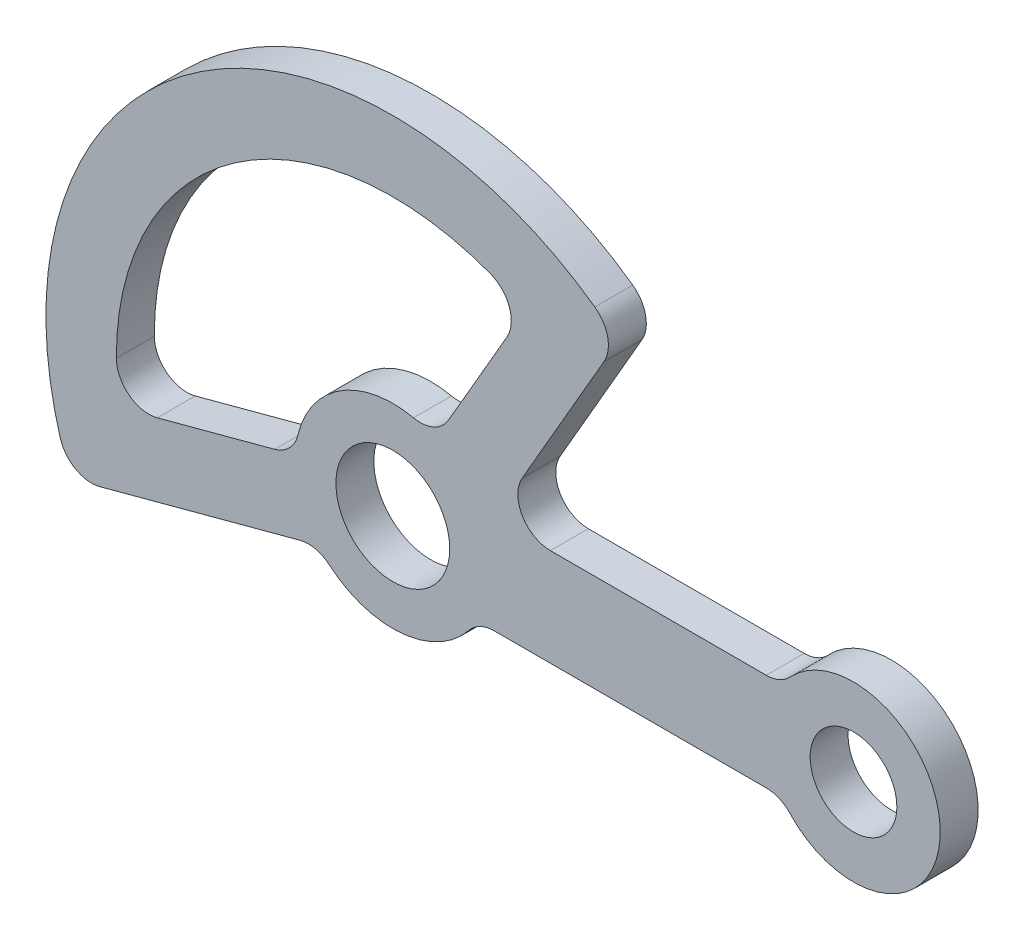
from build123d import *

# Parameters (mm, degrees)
SZKIC1_R                    = 18
SZKIC1_R_2                  = 10.5
SZKIC1_R_3                  = 16
SZKIC1_R_4                  = 8
DODANIE_WYCI_GNI_CIE1_DEPTH = 7


with BuildPart() as part:
    # Szkic1 → Dodanie-wyciągnięcie1 (new body)
    # profile 1 of 3: a face of its own
    with BuildSketch(Plane.XY):
        with BuildLine():
            Line((68.906523061, 9), (29.071509826, 9))
            ThreePointArc((29.071509826, 9), (23.875357404, 12), (23.875357404, 18))
            Line((23.875357404, 18), (38.973056312, 44.149981587))
            ThreePointArc((38.973056312, 44.149981587), (39.641584345, 48.417073987), (37.271066361, 52.027565889))
            ThreePointArc((37.271066361, 52.027565889), (-37.146015536, 52.116921722), (-61.340613737, -18.257302823))
            ThreePointArc((-61.340613737, -18.257302823), (-58.51823129, -21.782574666), (-54.037016928, -22.341235641))
            Line((-54.037016928, -22.341235641), (-17.13928203, -12.454517373))
            ThreePointArc((-17.13928203, -12.454517373), (-14.262244941, -12.398004426), (-11.68977582, -13.687554248))
            ThreePointArc((-11.68977582, -13.687554248), (-17.112889149, -5.581131156), (-17.511771596, 4.163875068))
            ThreePointArc((-17.511771596, 4.163875068), (-19.046659036, 1.369774785), (-21.796114524, -0.243721533))
            Line((-21.796114524, -0.243721533), (-43.446394932, -6.044896685))
            ThreePointArc((-43.446394932, -6.044896685), (-48.638675969, -5.019562848), (-50.999217096, -0.282587291))
            ThreePointArc((-50.999217096, -0.282587291), (-29.136896009, 41.857392309), (17.972237006, 47.728384605))
            ThreePointArc((17.972237006, 47.728384605), (21.50727904, 44.134176714), (21.054008604, 39.113280534))
            Line((21.054008604, 39.113280534), (10.281653378, 20.455013964))
            ThreePointArc((10.281653378, 20.455013964), (7.514747752, 17.968780283), (3.814125716, 17.591260473))
            ThreePointArc((3.814125716, 17.591260473), (14.011678395, 11.299241946), (18, 0))
            ThreePointArc((18, 0), (16.984145827, -5.961441984), (14.051245496, -11.25))
            ThreePointArc((14.051245496, -11.25), (16.136917784, -9.591673087), (18.734993995, -9))
            Line((18.734993995, -9), (68.906523061, -9))
            ThreePointArc((68.906523061, -9), (71.299695166, -9.497934272), (73.295653135, -10.909090909))
            ThreePointArc((73.295653135, -10.909090909), (69, 0), (73.295653135, 10.909090909))
            ThreePointArc((73.295653135, 10.909090909), (71.299695166, 9.497934272), (68.906523061, 9))
        make_face()
    # profile 2 of 3: a face of its own
    with BuildSketch(Plane.XY):
        Circle(SZKIC1_R)
        Circle(SZKIC1_R_2, mode=Mode.SUBTRACT)
    # profile 3 of 3: a face of its own
    with BuildSketch(Plane.XY):
        with Locations((85, 0)):
            Circle(SZKIC1_R_3)
        with Locations((85, 0)):
            Circle(SZKIC1_R_4, mode=Mode.SUBTRACT)
    extrude(amount=DODANIE_WYCI_GNI_CIE1_DEPTH)


solid = part.part
